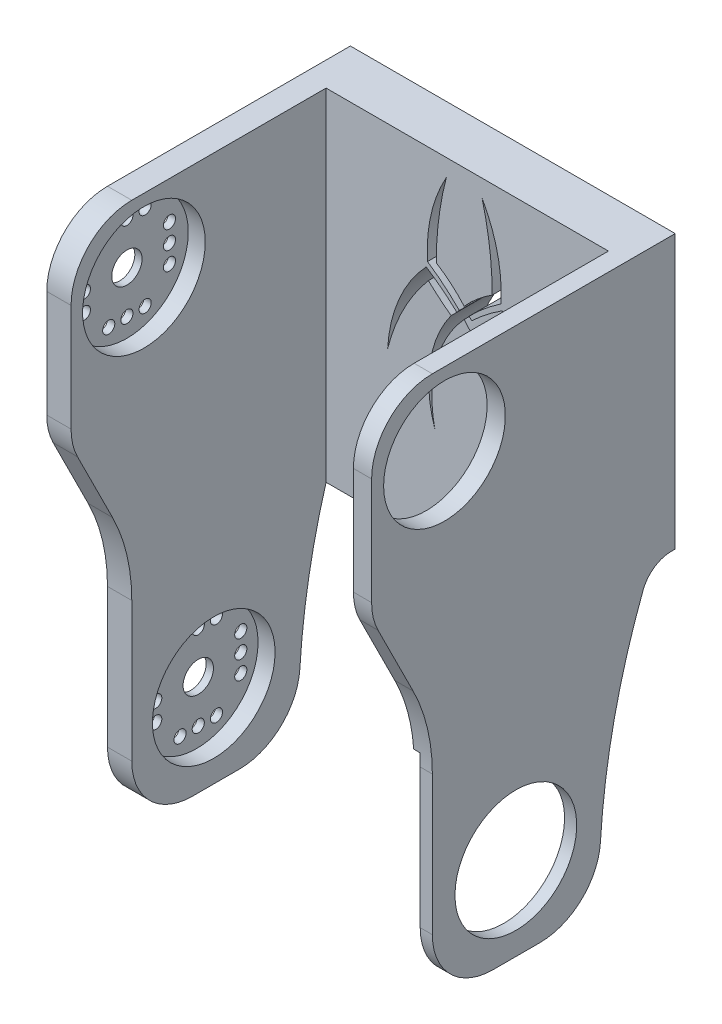
from build123d import *

# Parameters (mm, degrees)
BOSS_EXTRUDE1_DEPTH = 90
SKETCH2_R           = 10.1
CUT_EXTRUDE1_DEPTH  = 2.8
SKETCH3_R           = 2.5
SKETCH3_R_2         = 1
CUT_EXTRUDE2_DEPTH  = 2.8
SKETCH4_R           = 10.1
CUT_EXTRUDE3_DEPTH  = 2.8
SKETCH5_R           = 2.5
SKETCH5_R_2         = 1
CUT_EXTRUDE4_DEPTH  = 2.8
SKETCH6_R           = 10.025
CUT_EXTRUDE5_DEPTH  = 12.8
CUT_EXTRUDE7_DEPTH  = 62.8
FILLET1_R           = 10
SKETCH9_W           = 1
SKETCH9_H           = 35
CUT_EXTRUDE8_DEPTH  = 50
CUT_EXTRUDE10_DEPTH = 10


with BuildPart() as part:
    # Sketch1 → Boss-Extrude1 (new body)
    with BuildSketch(Plane(origin=(0, 0, 0), x_dir=(1, 0, 0), z_dir=(0, 1, 0))):
        Polygon((-23.25, 0), (-23.25, 42), (23.25, 42), (23.25, 0), (26.25, 0), (26.25, 50), (-27.25, 50), (-27.25, 0), align=None)
    extrude(amount=BOSS_EXTRUDE1_DEPTH)

    # Sketch2 → Cut-Extrude1 (cut)
    with BuildSketch(Plane(origin=(-23.25, 0, 0), x_dir=(0, 0, -1), z_dir=(1, 0, 0))):
        with Locations((12, 78)):
            Circle(SKETCH2_R)
    extrude(amount=-CUT_EXTRUDE1_DEPTH, mode=Mode.SUBTRACT)

    # Sketch3 → Cut-Extrude2 (cut)
    with BuildSketch(Plane(origin=(-26.05, 0, 0), x_dir=(0, 0, -1), z_dir=(1, 0, 0))):
        with Locations((12, 78)):
            Circle(SKETCH3_R)
        with Locations((12, 85)):
            Circle(SKETCH3_R_2)
        with Locations((9, 85)):
            Circle(SKETCH3_R_2)
        with Locations((15, 85)):
            Circle(SKETCH3_R_2)
        with Locations((19, 78)):
            Circle(SKETCH3_R_2)
        with Locations((19, 81)):
            Circle(SKETCH3_R_2)
        with Locations((19, 75)):
            Circle(SKETCH3_R_2)
        with Locations((12, 71)):
            Circle(SKETCH3_R_2)
        with Locations((15, 71)):
            Circle(SKETCH3_R_2)
        with Locations((9, 71)):
            Circle(SKETCH3_R_2)
        with Locations((5, 78)):
            Circle(SKETCH3_R_2)
        with Locations((5, 75)):
            Circle(SKETCH3_R_2)
        with Locations((5, 81)):
            Circle(SKETCH3_R_2)
    extrude(amount=-CUT_EXTRUDE2_DEPTH, mode=Mode.SUBTRACT)

    # Sketch4 → Cut-Extrude3 (cut)
    with BuildSketch(Plane(origin=(-23.25, 0, 0), x_dir=(0, 0, -1), z_dir=(1, 0, 0))):
        with Locations((23.5, 13.75)):
            Circle(SKETCH4_R)
    extrude(amount=-CUT_EXTRUDE3_DEPTH, mode=Mode.SUBTRACT)

    # Sketch5 → Cut-Extrude4 (cut)
    with BuildSketch(Plane(origin=(-26.05, 0, 0), x_dir=(0, 0, -1), z_dir=(1, 0, 0))):
        with Locations((23.75, 13.75)):
            Circle(SKETCH5_R)
        with Locations((23.75, 20.75)):
            Circle(SKETCH5_R_2)
        with Locations((20.75, 20.75)):
            Circle(SKETCH5_R_2)
        with Locations((26.75, 20.75)):
            Circle(SKETCH5_R_2)
        with Locations((30.75, 16.75)):
            Circle(SKETCH5_R_2)
        with Locations((30.75, 13.75)):
            Circle(SKETCH5_R_2)
        with Locations((30.75, 10.75)):
            Circle(SKETCH5_R_2)
        with Locations((26.75, 6.75)):
            Circle(SKETCH5_R_2)
        with Locations((23.75, 6.75)):
            Circle(SKETCH5_R_2)
        with Locations((20.75, 6.75)):
            Circle(SKETCH5_R_2)
        with Locations((16.75, 10.75)):
            Circle(SKETCH5_R_2)
        with Locations((16.75, 13.75)):
            Circle(SKETCH5_R_2)
        with Locations((16.75, 16.75)):
            Circle(SKETCH5_R_2)
    extrude(amount=-CUT_EXTRUDE4_DEPTH, mode=Mode.SUBTRACT)

    # Sketch6 → Cut-Extrude5 (cut)
    with BuildSketch(Plane.ZY.offset(-23.25)):
        with Locations((-12, 78)):
            Circle(SKETCH6_R)
        with Locations((-23.75, 13.75)):
            Circle(SKETCH6_R)
    extrude(amount=-CUT_EXTRUDE5_DEPTH, mode=Mode.SUBTRACT)

    # Sketch8 → Cut-Extrude7 (cut)
    with BuildSketch(Plane.ZY.offset(27.25)):
        with BuildLine():
            Line((0, 60), (-6.83281573, 46.33436854))
            ThreePointArc((-6.83281573, 46.33436854), (-9.197469684, 39.810548291), (-10, 32.917960675))
            Line((-10, 32.917960675), (-10, 0))
            Line((-10, 0), (0, 0))
            Line((0, 0), (0, 60))
        make_face()
        with BuildLine():
            Line((-50, 45), (-49.384007447, 45))
            ThreePointArc((-49.384007447, 45), (-46.548633561, 44.118331571), (-44.713203531, 41.784261971))
            ThreePointArc((-44.713203531, 41.784261971), (-39.074197476, 21.242984276), (-37.5, 0))
            Line((-37.5, 0), (-50, 0))
            Line((-50, 0), (-50, 45))
        make_face()
    extrude(amount=-CUT_EXTRUDE7_DEPTH, mode=Mode.SUBTRACT)

    # Fillet1
    fillet1_edges = [part.edges().sort_by_distance(p)[0] for p in [
        (24.75, 0, -37.5),
        (-25.25, 0, -37.5),
        (-25.25, 0, -10),
        (24.75, 0, -10),
        (-25.25, 60, 0),
        (24.75, 60, 0),
        (24.75, 90, 0),
        (-25.25, 90, 0),
    ]]
    fillet(fillet1_edges, radius=FILLET1_R)

    # Sketch9 → Cut-Extrude8 (cut)
    with BuildSketch(Plane.XY):
        with Locations((23.75, 17.5)):
            Rectangle(SKETCH9_W, SKETCH9_H)
    extrude(amount=-CUT_EXTRUDE8_DEPTH, mode=Mode.SUBTRACT)

    # Sketch10 → Cut-Extrude10 (cut)
    with BuildSketch(Plane(origin=(0, 0, -50), x_dir=(-1, 0, 0), z_dir=(0, 0, -1))):
        with BuildLine():
            ThreePointArc((-5.545477523, 73.609473243), (-2.815070752, 71.565748615), (-0.314206668, 69.246781102))
            Line((-0.314206668, 69.246781102), (-0.718251382, 68.789336849))
            ThreePointArc((-0.718251382, 68.789336849), (-3.14462395, 70.886777127), (-5.763285342, 72.738574113))
            ThreePointArc((-5.763285342, 72.738574113), (-10.24623891, 65.875737216), (-12.109021951, 57.892915514))
            ThreePointArc((-12.109021951, 57.892915514), (-9.506202014, 64.812112187), (-5.398575101, 70.958440796))
            ThreePointArc((-5.398575101, 70.958440796), (-3.57730753, 69.344405913), (-1.663670975, 67.841036595))
            ThreePointArc((-1.663670975, 67.841036595), (-5.130037281, 59.38820373), (-4.32695717, 50.287591599))
            ThreePointArc((-4.32695717, 50.287591599), (-4.15407751, 59.927406093), (0.5, 68.371070782))
            ThreePointArc((0.5, 68.371070782), (5.15407751, 59.927406093), (5.32695717, 50.287591599))
            ThreePointArc((5.32695717, 50.287591599), (6.130037281, 59.38820373), (2.663670975, 67.841036595))
            ThreePointArc((2.663670975, 67.841036595), (4.57730753, 69.344405913), (6.398575101, 70.958440796))
            ThreePointArc((6.398575101, 70.958440796), (10.506202014, 64.812112187), (13.109021951, 57.892915514))
            ThreePointArc((13.109021951, 57.892915514), (11.24623891, 65.875737216), (6.763285342, 72.738574113))
            ThreePointArc((6.763285342, 72.738574113), (4.14462395, 70.886777127), (1.718251382, 68.789336849))
            Line((1.718251382, 68.789336849), (1.314206668, 69.246781102))
            ThreePointArc((1.314206668, 69.246781102), (3.815070752, 71.565748615), (6.545477523, 73.609473243))
            ThreePointArc((6.545477523, 73.609473243), (5.969361402, 80.609191571), (3.438503197, 87.160735145))
            ThreePointArc((3.438503197, 87.160735145), (4.689876448, 80.708142635), (5.106185309, 74.148525875))
            ThreePointArc((5.106185309, 74.148525875), (2.663670975, 72.36347608), (0.5, 70.249047799))
            ThreePointArc((0.5, 70.249047799), (-1.663670975, 72.36347608), (-4.106185309, 74.148525875))
            ThreePointArc((-4.106185309, 74.148525875), (-3.689876448, 80.708142635), (-2.438503197, 87.160735145))
            ThreePointArc((-2.438503197, 87.160735145), (-4.969361402, 80.609191571), (-5.545477523, 73.609473243))
        make_face()
    extrude(amount=-CUT_EXTRUDE10_DEPTH, mode=Mode.SUBTRACT)


solid = part.part
